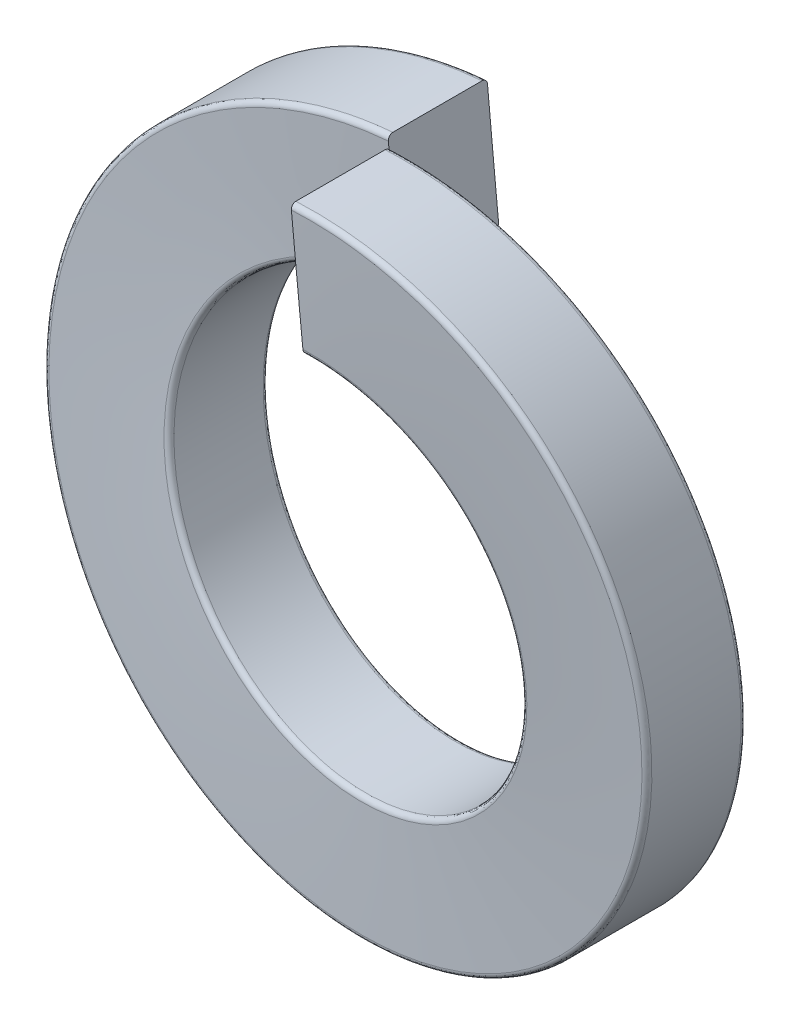
from build123d import *

# Parameters (mm, degrees)
SWEEP1_PITCH            = 6.985
SWEEP1_HEIGHT           = 6.985
SWEEP1_RADIUS           = 21.0312
SWEEP1_START_ANGLE      = 90
SKETCH4_W               = 6.35
SKETCH4_H               = 8.0264
FILLET1_R               = 0.3175
CUT_EXTRUDE1_DEPTH      = 31.551807358
CUT_EXTRUDE1_DEPTH_BACK = 31.551807358


with BuildPart() as part:
    # Sweep1: sweep along a helix
    with BuildLine() as sweep1_path:
        add(Helix(SWEEP1_PITCH, SWEEP1_HEIGHT, SWEEP1_RADIUS, center=(0, 0, -6.985), direction=(0, 0, 1), mode=Mode.PRIVATE).rotate(Axis((0, 0, -6.985), (0, 0, 1)), SWEEP1_START_ANGLE))
    # Sketch4 → Sweep1 (sweep)
    with BuildSketch(Plane(origin=(0, 0, 0), x_dir=(0, 0, -1), z_dir=(1, 0, 0))):
        with Locations((3.81, 17.018)):
            Rectangle(SKETCH4_W, SKETCH4_H)
    sweep(path=sweep1_path.line, is_frenet=True)

    # Fillet1
    fillet1_edges = [part.edges().sort_by_distance(p)[0] for p in [
        (0, -21.031177359, 2.8575),
        (0, -13.004786, 2.857500001),
        (0, -13.004785999, -3.492499999),
        (0, -21.031177358, -3.4925),
    ]]
    fillet(fillet1_edges, radius=FILLET1_R)

    # Sketch5 → Cut-Extrude1 (cut, two sides: drawn at the far end of the back side and taken through both)
    with BuildSketch(Plane.XY.offset(-CUT_EXTRUDE1_DEPTH_BACK)):
        with BuildLine():
            Line((0, 21.0312), (0.737066365, 12.983896034))
            Line((0.737066365, 12.983896034), (0.737066365, 0))
            Line((0.737066365, 0), (0, 0))
            Line((0, 0), (0, 13.0048))
            Line((0, 13.0048), (-0.733978295, 21.018388361))
            ThreePointArc((-0.733978295, 21.018388361), (-0.36704505, 21.027996846), (0, 21.0312))
        make_face()
    extrude(amount=CUT_EXTRUDE1_DEPTH + CUT_EXTRUDE1_DEPTH_BACK, mode=Mode.SUBTRACT)


solid = part.part
